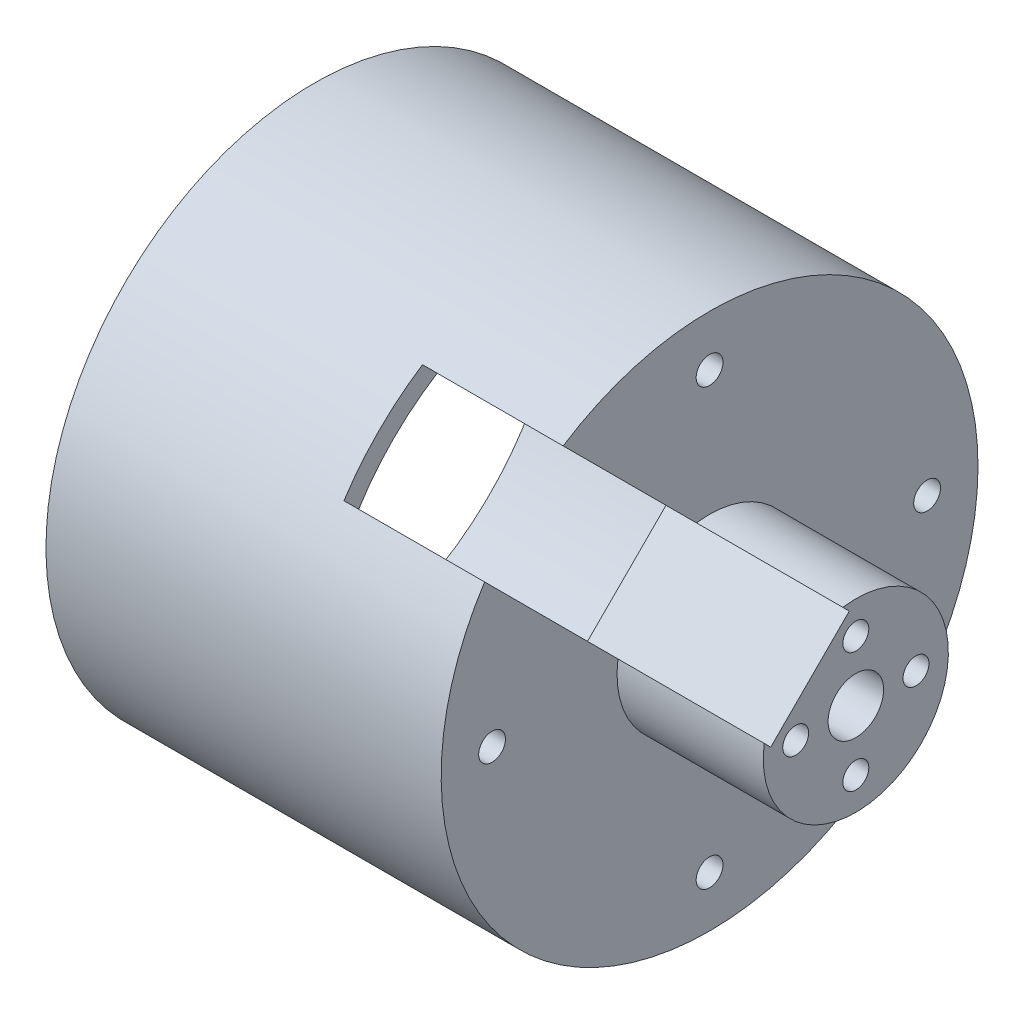
from build123d import *

# Parameters (mm, degrees)
F_0000_CYLINDER_SKETCH_R     = 29
F_0000_CYLINDER_DEPTH        = 42.7
F_0000_CYLINDER_ROTATE_ANGLE = 90
F_0002_CYLINDER_SKETCH_R     = 26.8
F_0002_CYLINDER_DEPTH        = 39.7
F_0002_CYLINDER_ROTATE_ANGLE = 90
F_0005_CYLINDER_SKETCH_R     = 10
F_0005_CYLINDER_DEPTH        = 16.3
F_0005_CYLINDER_ROTATE_ANGLE = 90
F_0008_CYLINDER_SKETCH_R     = 3
F_0008_CYLINDER_DEPTH        = 20.9
F_0008_CYLINDER_ROTATE_ANGLE = 90
F_0011_CYLINDER_SKETCH_R     = 1.45
F_0011_CYLINDER_DEPTH        = 4.2
F_0011_CYLINDER_ROTATE_ANGLE = 90
F_0015_CYLINDER_SKETCH_R     = 1.45
F_0015_CYLINDER_DEPTH        = 4.2
F_0015_CYLINDER_ROTATE_ANGLE = 90
F_0019_CYLINDER_SKETCH_R     = 1.45
F_0019_CYLINDER_DEPTH        = 4.2
F_0019_CYLINDER_ROTATE_ANGLE = 90
F_0023_CYLINDER_SKETCH_R     = 1.45
F_0023_CYLINDER_DEPTH        = 4.2
F_0023_CYLINDER_ROTATE_ANGLE = 90
F_0027_BOX_SKETCH_W          = 31.1
F_0027_BOX_SKETCH_H          = 12
F_0027_BOX_DEPTH             = 28
F_0027_BOX_ROTATE_ANGLE      = 45
F_0031_CYLINDER_SKETCH_R     = 1.4
F_0031_CYLINDER_DEPTH        = 12.02
F_0031_CYLINDER_ROTATE_ANGLE = 90
F_0035_CYLINDER_SKETCH_R     = 1.4
F_0035_CYLINDER_DEPTH        = 12.02
F_0035_CYLINDER_ROTATE_ANGLE = 90
F_0039_CYLINDER_SKETCH_R     = 1.4
F_0039_CYLINDER_DEPTH        = 12.02
F_0039_CYLINDER_ROTATE_ANGLE = 90
F_0043_CYLINDER_SKETCH_R     = 1.4
F_0043_CYLINDER_DEPTH        = 12.02
F_0043_CYLINDER_ROTATE_ANGLE = 90
F_0047_CONE_ROTATE_ANGLE     = 120


with BuildPart() as part:
    # 0000_cylinder_Sketch → 0000_cylinder (new body)
    with BuildSketch(Plane.XY):
        with Locations(Location((0, 0, 0), (0, 0, 180))):
            Circle(F_0000_CYLINDER_SKETCH_R)
    extrude(amount=F_0000_CYLINDER_DEPTH)


with BuildPart() as part_1:
    # 0000_cylinder_Rotate: moved
    add(part.part.rotate(Axis((0, 0, 0), (0, 1, 0)), F_0000_CYLINDER_ROTATE_ANGLE))


with BuildPart() as part_2:
    # 0000_cylinder_Translate: moved
    add(part_1.part.moved(Location((-21.5, 0, 0))))


with BuildPart() as body_2:
    # 0002_cylinder_Sketch → 0002_cylinder (new body)
    with BuildSketch(Plane.XY):
        Circle(F_0002_CYLINDER_SKETCH_R)
    extrude(amount=F_0002_CYLINDER_DEPTH)


with BuildPart() as body_2_1:
    # 0002_cylinder_Rotate: moved
    add(body_2.part.rotate(Axis((0, 0, 0), (0, 1, 0)), F_0002_CYLINDER_ROTATE_ANGLE))


with BuildPart() as body_2_2:
    # 0002_cylinder_Translate: moved
    add(body_2_1.part.moved(Location((-22.5, 0, 0))))


with BuildPart() as part_3:
    add(part_2.part)

    # 0004_sub: cut body 2
    add(body_2_2.part, mode=Mode.SUBTRACT)


with BuildPart() as body_2_2_1:
    # 0005_cylinder_Sketch → 0005_cylinder (new body)
    with BuildSketch(Plane.XY):
        Circle(F_0005_CYLINDER_SKETCH_R)
    extrude(amount=F_0005_CYLINDER_DEPTH)


with BuildPart() as body_2_2_2:
    # 0005_cylinder_Rotate: moved
    add(body_2_2_1.part.rotate(Axis((0, 0, 0), (0, 1, 0)), F_0005_CYLINDER_ROTATE_ANGLE))


with BuildPart() as body_2_2_3:
    # 0005_cylinder_Translate: moved
    add(body_2_2_2.part.moved(Location((20.7, 0, 0))))


with BuildPart() as part_4:
    add(part_3.part)

    # 0007_add: union body 2 2
    add(body_2_2_3.part)


with BuildPart() as body_2_3:
    # 0008_cylinder_Sketch → 0008_cylinder (new body)
    with BuildSketch(Plane.XY):
        Circle(F_0008_CYLINDER_SKETCH_R)
    extrude(amount=F_0008_CYLINDER_DEPTH)


with BuildPart() as body_2_3_1:
    # 0008_cylinder_Rotate: moved
    add(body_2_3.part.rotate(Axis((0, 0, 0), (0, 1, 0)), F_0008_CYLINDER_ROTATE_ANGLE))


with BuildPart() as body_2_3_2:
    # 0008_cylinder_Translate: moved
    add(body_2_3_1.part.moved(Location((17.1, 0, 0))))


with BuildPart() as part_5:
    add(part_4.part)

    # 0010_sub: cut body 2 3
    add(body_2_3_2.part, mode=Mode.SUBTRACT)


with BuildPart() as body_2_4:
    # 0011_cylinder_Sketch → 0011_cylinder (new body)
    with BuildSketch(Plane.XY):
        Circle(F_0011_CYLINDER_SKETCH_R)
    extrude(amount=F_0011_CYLINDER_DEPTH)


with BuildPart() as body_2_4_1:
    # 0011_cylinder_Rotate: moved
    add(body_2_4.part.rotate(Axis((0, 0, 0), (0, 1, 0)), F_0011_CYLINDER_ROTATE_ANGLE))


with BuildPart() as body_2_4_2:
    # 0011_cylinder_Translate: moved
    add(body_2_4_1.part.moved(Location((17.1, 23.5, 0))))


with BuildPart() as part_6:
    add(part_5.part)

    # 0014_sub: cut body 2 4
    add(body_2_4_2.part, mode=Mode.SUBTRACT)


with BuildPart() as body_2_5:
    # 0015_cylinder_Sketch → 0015_cylinder (new body)
    with BuildSketch(Plane.XY):
        Circle(F_0015_CYLINDER_SKETCH_R)
    extrude(amount=F_0015_CYLINDER_DEPTH)


with BuildPart() as body_2_5_1:
    # 0015_cylinder_Rotate: moved
    add(body_2_5.part.rotate(Axis((0, 0, 0), (0, 1, 0)), F_0015_CYLINDER_ROTATE_ANGLE))


with BuildPart() as body_2_5_2:
    # 0015_cylinder_Translate: moved
    add(body_2_5_1.part.moved(Location((17.1, 0, 23.5))))


with BuildPart() as part_7:
    add(part_6.part)

    # 0018_sub: cut body 2 5
    add(body_2_5_2.part, mode=Mode.SUBTRACT)


with BuildPart() as body_2_6:
    # 0019_cylinder_Sketch → 0019_cylinder (new body)
    with BuildSketch(Plane.XY):
        Circle(F_0019_CYLINDER_SKETCH_R)
    extrude(amount=F_0019_CYLINDER_DEPTH)


with BuildPart() as body_2_6_1:
    # 0019_cylinder_Rotate: moved
    add(body_2_6.part.rotate(Axis((0, 0, 0), (0, 1, 0)), F_0019_CYLINDER_ROTATE_ANGLE))


with BuildPart() as body_2_6_2:
    # 0019_cylinder_Translate: moved
    add(body_2_6_1.part.moved(Location((17.1, -23.5, 0))))


with BuildPart() as part_8:
    add(part_7.part)

    # 0022_sub: cut body 2 6
    add(body_2_6_2.part, mode=Mode.SUBTRACT)


with BuildPart() as body_2_7:
    # 0023_cylinder_Sketch → 0023_cylinder (new body)
    with BuildSketch(Plane.XY):
        Circle(F_0023_CYLINDER_SKETCH_R)
    extrude(amount=F_0023_CYLINDER_DEPTH)


with BuildPart() as body_2_7_1:
    # 0023_cylinder_Rotate: moved
    add(body_2_7.part.rotate(Axis((0, 0, 0), (0, 1, 0)), F_0023_CYLINDER_ROTATE_ANGLE))


with BuildPart() as body_2_7_2:
    # 0023_cylinder_Translate: moved
    add(body_2_7_1.part.moved(Location((17.1, 0, -23.5))))


with BuildPart() as part_9:
    add(part_8.part)

    # 0026_sub: cut body 2 7
    add(body_2_7_2.part, mode=Mode.SUBTRACT)


with BuildPart() as body_2_8:
    # 0027_box_Sketch → 0027_box (new body)
    with BuildSketch(Plane.XY):
        with Locations((15.55, 6)):
            Rectangle(F_0027_BOX_SKETCH_W, F_0027_BOX_SKETCH_H)
    extrude(amount=F_0027_BOX_DEPTH)


with BuildPart() as body_2_8_1:
    # 0027_box_Rotate: moved
    add(body_2_8.part.rotate(Axis((0, 0, 0), (-1, 0, 0)), F_0027_BOX_ROTATE_ANGLE))


with BuildPart() as body_2_8_2:
    # 0027_box_Translate: moved
    add(body_2_8_1.part.moved(Location((6, 0.707106781, 9.192388155))))


with BuildPart() as part_10:
    add(part_9.part)

    # 0030_sub: cut body 2 8
    add(body_2_8_2.part, mode=Mode.SUBTRACT)


with BuildPart() as body_2_9:
    # 0031_cylinder_Sketch → 0031_cylinder (new body)
    with BuildSketch(Plane.XY):
        with Locations(Location((0, 0, 0), (0, 0, 180))):
            Circle(F_0031_CYLINDER_SKETCH_R)
    extrude(amount=F_0031_CYLINDER_DEPTH)


with BuildPart() as body_2_9_1:
    # 0031_cylinder_Rotate: moved
    add(body_2_9.part.rotate(Axis((0, 0, 0), (0, 1, 0)), F_0031_CYLINDER_ROTATE_ANGLE))


with BuildPart() as body_2_9_2:
    # 0031_cylinder_Translate: moved
    add(body_2_9_1.part.moved(Location((24.99, 6.5, 0))))


with BuildPart() as part_11:
    add(part_10.part)

    # 0034_sub: cut body 2 9
    add(body_2_9_2.part, mode=Mode.SUBTRACT)


with BuildPart() as body_2_10:
    # 0035_cylinder_Sketch → 0035_cylinder (new body)
    with BuildSketch(Plane.XY):
        with Locations(Location((0, 0, 0), (0, 0, 180))):
            Circle(F_0035_CYLINDER_SKETCH_R)
    extrude(amount=F_0035_CYLINDER_DEPTH)


with BuildPart() as body_2_10_1:
    # 0035_cylinder_Rotate: moved
    add(body_2_10.part.rotate(Axis((0, 0, 0), (0, 1, 0)), F_0035_CYLINDER_ROTATE_ANGLE))


with BuildPart() as body_2_10_2:
    # 0035_cylinder_Translate: moved
    add(body_2_10_1.part.moved(Location((24.99, 0, 6.5))))


with BuildPart() as part_12:
    add(part_11.part)

    # 0038_sub: cut body 2 10
    add(body_2_10_2.part, mode=Mode.SUBTRACT)


with BuildPart() as body_2_11:
    # 0039_cylinder_Sketch → 0039_cylinder (new body)
    with BuildSketch(Plane.XY):
        with Locations(Location((0, 0, 0), (0, 0, 180))):
            Circle(F_0039_CYLINDER_SKETCH_R)
    extrude(amount=F_0039_CYLINDER_DEPTH)


with BuildPart() as body_2_11_1:
    # 0039_cylinder_Rotate: moved
    add(body_2_11.part.rotate(Axis((0, 0, 0), (0, 1, 0)), F_0039_CYLINDER_ROTATE_ANGLE))


with BuildPart() as body_2_11_2:
    # 0039_cylinder_Translate: moved
    add(body_2_11_1.part.moved(Location((24.99, -6.5, 0))))


with BuildPart() as part_13:
    add(part_12.part)

    # 0042_sub: cut body 2 11
    add(body_2_11_2.part, mode=Mode.SUBTRACT)


with BuildPart() as body_2_12:
    # 0043_cylinder_Sketch → 0043_cylinder (new body)
    with BuildSketch(Plane.XY):
        with Locations(Location((0, 0, 0), (0, 0, 180))):
            Circle(F_0043_CYLINDER_SKETCH_R)
    extrude(amount=F_0043_CYLINDER_DEPTH)


with BuildPart() as body_2_12_1:
    # 0043_cylinder_Rotate: moved
    add(body_2_12.part.rotate(Axis((0, 0, 0), (0, 1, 0)), F_0043_CYLINDER_ROTATE_ANGLE))


with BuildPart() as body_2_12_2:
    # 0043_cylinder_Translate: moved
    add(body_2_12_1.part.moved(Location((24.99, 0, -6.5))))


with BuildPart() as part_14:
    add(part_13.part)

    # 0046_sub: cut body 2 12
    add(body_2_12_2.part, mode=Mode.SUBTRACT)


with BuildPart() as body_2_13:
    # 0047_cone_Sketch → 0047_cone (revolve)
    with BuildSketch(Plane.XY, mode=Mode.PRIVATE) as f_0047_cone_sk:
        Polygon((0, 0), (26.8, 0), (27.3, 0.51), (0, 0.51), align=None)
    revolve(f_0047_cone_sk.sketch.rotate(Axis((0, -100, 0), (0, 1, 0)), 90), axis=Axis((0, -100, 0), (0, 1, 0)))


with BuildPart() as body_2_13_1:
    # 0047_cone_Rotate: moved
    add(body_2_13.part.rotate(Axis((0, 0, 0), (0.5773502691896258, -0.5773502691896257, -0.5773502691896257)), F_0047_CONE_ROTATE_ANGLE))


with BuildPart() as body_2_13_2:
    # 0047_cone_Translate: moved
    add(body_2_13_1.part.moved(Location((-21, 0, 0))))


with BuildPart() as part_15:
    add(part_14.part)

    # 0050_sub: cut body 2 13
    add(body_2_13_2.part, mode=Mode.SUBTRACT)


solid = part_15.part
